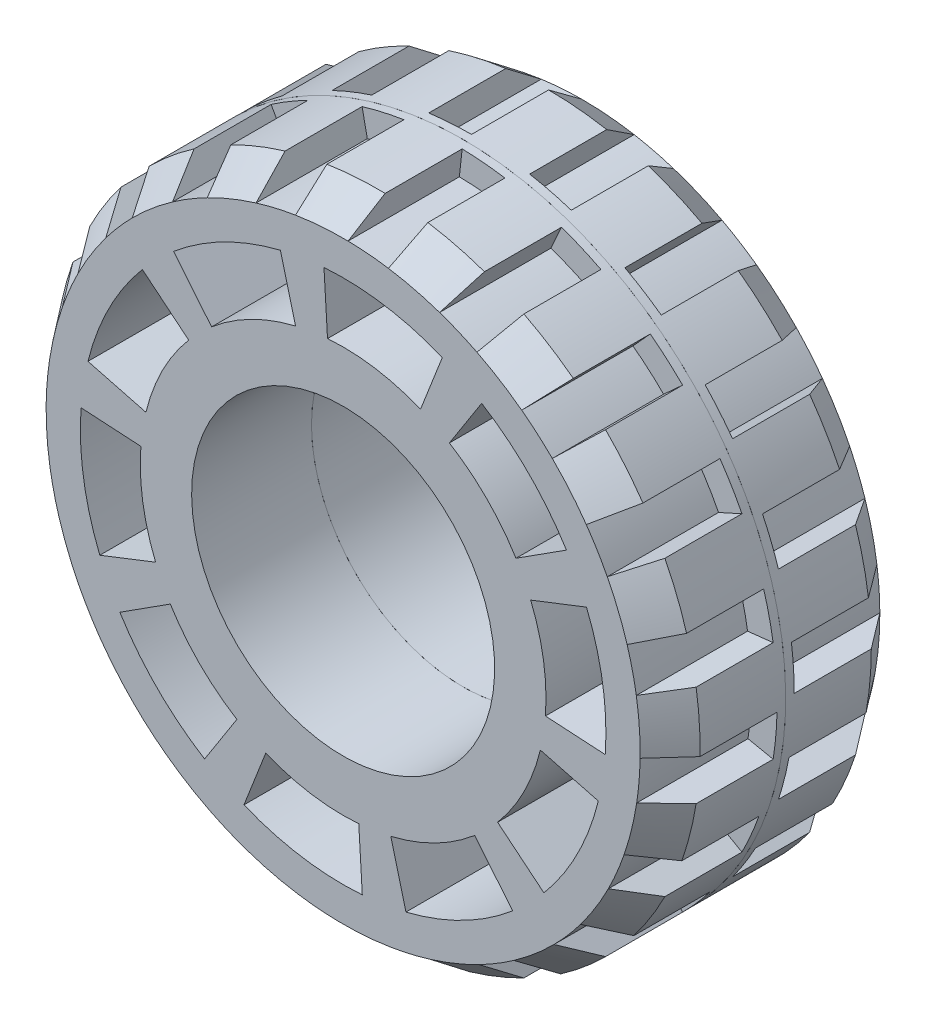
from build123d import *

# Parameters (mm, degrees)
CUT_EXTRUDE1_DEPTH    = 5
CIRPATTERN1_COUNT     = 10
CUT_EXTRUDE2_DEPTH    = 6.5
CIRPATTERN2_COUNT     = 20
BODY_MOVE_COPY1_ANGLE = 9


with BuildPart() as part:
    # Sketch2 → Revolve1 (revolve)
    with BuildSketch(Plane(origin=(0, 0, 0), x_dir=(0, 0, -1), z_dir=(1, 0, 0)), mode=Mode.PRIVATE) as revolve1_sk:
        Polygon((0, 8.85), (0, 18.85), (5, 18.85), (7, 17.35), (7, 8.85), align=None)
    revolve(revolve1_sk.sketch.rotate(Axis((0, 0, 10.899010646), (0, 0, -1)), 90), axis=Axis((0, 0, 10.899010646), (0, 0, -1)))

    # Sketch4 → Cut-Extrude1 (cut)
    with BuildSketch(Plane(origin=(0, 0, -7), x_dir=(-1, 0, 0), z_dir=(0, 0, -1))):
        with BuildLine():
            Line((14.945651542, 3.5), (11.526491227, 2.75))
            ThreePointArc((11.526491227, 2.75), (11.85, 0), (11.526491227, -2.75))
            Line((11.526491227, -2.75), (14.945651542, -3.5))
            ThreePointArc((14.945651542, -3.5), (15.35, 0), (14.945651542, 3.5))
        make_face()
    cut_extrude1 = extrude(amount=-CUT_EXTRUDE1_DEPTH, mode=Mode.SUBTRACT)

    # CirPattern1: Cut-Extrude1 ×10 about axis
    cirpattern1_axis = Axis((0, 0, 0), (0, 0, 1))
    for i in range(1, CIRPATTERN1_COUNT):
        add(cut_extrude1.rotate(cirpattern1_axis, i * 360 / CIRPATTERN1_COUNT), mode=Mode.SUBTRACT)

    # Sketch5 → Cut-Extrude2 (cut)
    with BuildSketch(Plane(origin=(0, 0, -7), x_dir=(-1, 0, 0), z_dir=(0, 0, -1))):
        with BuildLine():
            ThreePointArc((2.5, 18.68348201), (1.252769755, 18.808324432), (0, 18.85))
            Line((0, 18.85), (0.069605959, 17.349860374))
            ThreePointArc((0.069605959, 17.349860374), (1.252768933, 17.304712364), (2.430097548, 17.178973366))
            Line((2.430097548, 17.178973366), (2.5, 18.68348201))
        make_face()
    cut_extrude2 = extrude(amount=-CUT_EXTRUDE2_DEPTH, mode=Mode.SUBTRACT)

    # CirPattern2: Cut-Extrude2 ×20 about axis
    cirpattern2_axis = Axis((0, 0, 0), (0, 0, 1))
    for i in range(1, CIRPATTERN2_COUNT):
        add(cut_extrude2.rotate(cirpattern2_axis, i * 360 / CIRPATTERN2_COUNT), mode=Mode.SUBTRACT)

    # Mirror4: part across plane


with BuildPart() as part_1:
    add(part.part)
    add(part.part.mirror(Plane.XY))


with BuildPart() as body_2:
    # Split1: the piece on the far side of the plane
    add(part_1.part)
    split(bisect_by=Plane.XY, keep=Keep.BOTTOM)


with BuildPart() as part_2:
    add(part_1.part)

    # Split1
    split(bisect_by=Plane.XY, keep=Keep.TOP)


with BuildPart() as part_3:
    # Body-Move/Copy1: moved
    add(part_2.part.rotate(Axis((0, 0, 0), (0, 0, 1)), BODY_MOVE_COPY1_ANGLE))


solid = Compound([body_2.part, part_3.part])
